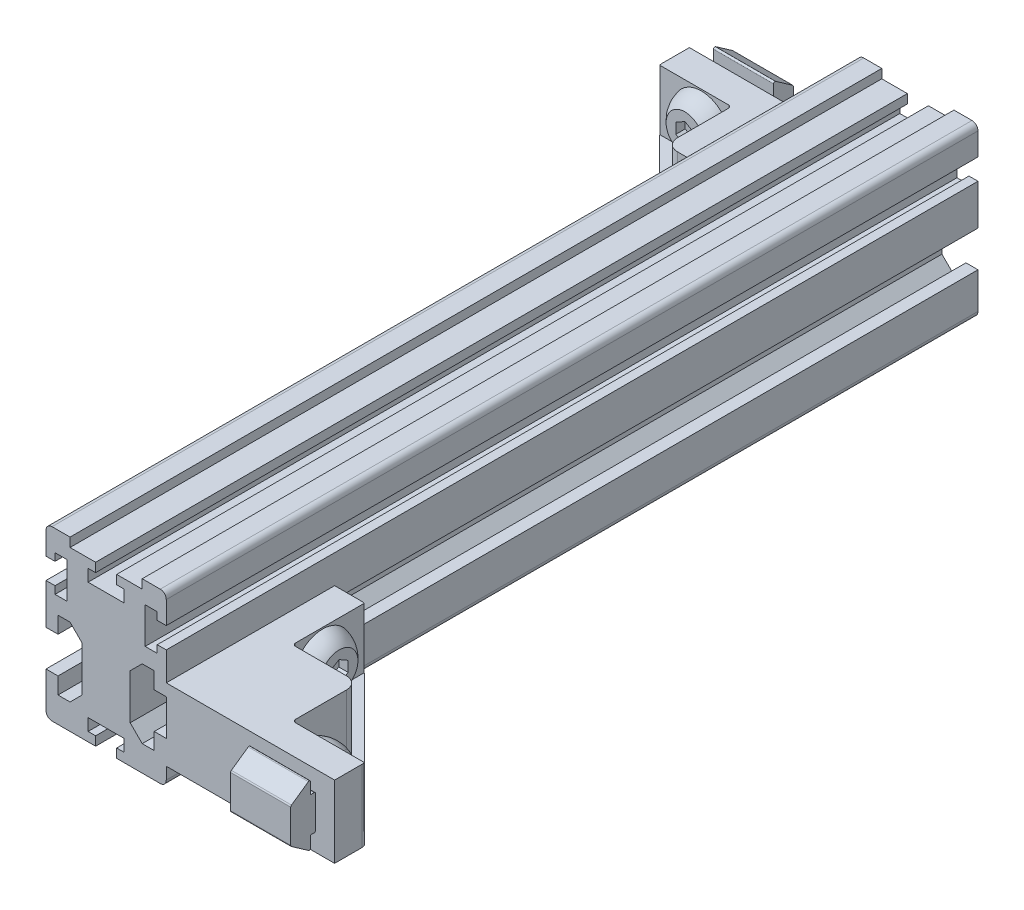
from build123d import *

# Parameters (mm, degrees)
BOSS_EXTRUDE1_DEPTH      = 135
BOSS_EXTRUDE2_START      = -7
BOSS_EXTRUDE2_DEPTH      = 12
CUT_EXTRUDE1_DEPTH       = 10
CUT_EXTRUDE2_DEPTH       = 1.56
BOSS_EXTRUDE3_DEPTH      = 5
CIRPATTERN1_COUNT        = 2
CIRPATTERN1_ANGLE        = 90
CIRPATTERN2_COUNT        = 2
CIRPATTERN2_ANGLE        = 180
CIRPATTERN2_COPY_2_DEPTH = 1.56
CIRPATTERN2_COPY_3_DEPTH = 5


with BuildPart() as part:
    # Sketch1 → Boss-Extrude1 (new body)
    with BuildSketch(Plane(origin=(24, 0, 0), x_dir=(-1, 0, 0), z_dir=(0, 0, -1))):
        with BuildLine():
            Line((14, 13), (14, 9.25))
            Line((14, 9.25), (15.5, 9.25))
            Line((15.5, 9.25), (15.5, 10.5))
            Line((15.5, 10.5), (17.5, 10.5))
            Line((17.5, 10.5), (17.5, 4.5))
            Line((17.5, 4.5), (15.5, 4.5))
            Line((15.5, 4.5), (15.5, 5.75))
            Line((15.5, 5.75), (14, 5.75))
            Line((14, 5.75), (14, -1))
            Line((14, -1), (16, -1))
            Line((16, -1), (16, 1.75))
            Line((16, 1.75), (18, 1.75))
            Line((18, 1.75), (20, -0.25))
            Line((20, -0.25), (20, -7.75))
            Line((20, -7.75), (18, -9.75))
            Line((18, -9.75), (16, -9.75))
            Line((16, -9.75), (16, -7))
            Line((16, -7), (14, -7))
            Line((14, -7), (14, -13))
            ThreePointArc((14, -13), (14.292893219, -13.707106781), (15, -14))
            Line((15, -14), (22.25, -14))
            Line((22.25, -14), (22.25, -12.5))
            Line((22.25, -12.5), (21, -12.5))
            Line((21, -12.5), (21, -10.5))
            Line((21, -10.5), (27, -10.5))
            Line((27, -10.5), (27, -12.5))
            Line((27, -12.5), (25.75, -12.5))
            Line((25.75, -12.5), (25.75, -14))
            Line((25.75, -14), (33, -14))
            ThreePointArc((33, -14), (33.707106781, -13.707106781), (34, -13))
            Line((34, -13), (34, -7))
            Line((34, -7), (32, -7))
            Line((32, -7), (32, -9.75))
            Line((32, -9.75), (30, -9.75))
            Line((30, -9.75), (28, -7.75))
            Line((28, -7.75), (28, -0.25))
            Line((28, -0.25), (30, 1.75))
            Line((30, 1.75), (32, 1.75))
            Line((32, 1.75), (32, -1))
            Line((32, -1), (34, -1))
            Line((34, -1), (34, 5.75))
            Line((34, 5.75), (32.5, 5.75))
            Line((32.5, 5.75), (32.5, 4.5))
            Line((32.5, 4.5), (30.5, 4.5))
            Line((30.5, 4.5), (30.5, 10.5))
            Line((30.5, 10.5), (32.5, 10.5))
            Line((32.5, 10.5), (32.5, 9.25))
            Line((32.5, 9.25), (34, 9.25))
            Line((34, 9.25), (34, 13))
            ThreePointArc((34, 13), (33.707106781, 13.707106781), (33, 14))
            Line((33, 14), (30, 14))
            Line((30, 14), (30, 12.5))
            Line((30, 12.5), (25.75, 12.5))
            Line((25.75, 12.5), (25.75, 11))
            Line((25.75, 11), (27, 11))
            Line((27, 11), (27, 9))
            Line((27, 9), (21, 9))
            Line((21, 9), (21, 11))
            Line((21, 11), (22.25, 11))
            Line((22.25, 11), (22.25, 12.5))
            Line((22.25, 12.5), (18, 12.5))
            Line((18, 12.5), (18, 14))
            Line((18, 14), (15, 14))
            ThreePointArc((15, 14), (14.292893219, 13.707106781), (14, 13))
        make_face()
    extrude(amount=BOSS_EXTRUDE1_DEPTH)

    # Sketch2 → Boss-Extrude2 (add)
    with BuildSketch(Plane(origin=(0, -4, 0), x_dir=(1, 0, 0), z_dir=(0, 1, 0)).offset(BOSS_EXTRUDE2_START)):
        with BuildLine():
            Line((-38, 135), (-10, 135))
            Line((-10, 135), (-10, 107))
            Line((-10, 107), (-14.585786438, 107))
            ThreePointArc((-14.585786438, 107), (-14.96846987, 107.076120467), (-15.292893219, 107.292893219))
            Line((-15.292893219, 107.292893219), (-37.707106781, 129.707106781))
            ThreePointArc((-37.707106781, 129.707106781), (-37.923879533, 130.03153013), (-38, 130.414213562))
            Line((-38, 130.414213562), (-38, 135))
        make_face()
    boss_extrude2 = extrude(amount=BOSS_EXTRUDE2_DEPTH)

    # Sketch3 → Cut-Extrude1 (cut)
    with BuildSketch(Plane(origin=(0, 1, 0), x_dir=(1, 0, 0), z_dir=(0, 1, 0))):
        with BuildLine():
            Line((-38, 130), (-26.5, 130))
            ThreePointArc((-26.5, 130), (-26.146446609, 129.853553391), (-26, 129.5))
            Line((-26, 129.5), (-26, 121))
            ThreePointArc((-26, 121), (-25.414213562, 119.585786438), (-24, 119))
            Line((-24, 119), (-15.5, 119))
            ThreePointArc((-15.5, 119), (-15.146446609, 118.853553391), (-15, 118.5))
            Line((-15, 118.5), (-15, 107))
            Line((-15, 107), (-38, 130))
        make_face()
    cut_extrude1 = extrude(amount=-CUT_EXTRUDE1_DEPTH, mode=Mode.SUBTRACT)

    # Sketch4 → Revolve1 (revolve)
    with BuildSketch(Plane(origin=(-31, 0, 0), x_dir=(0, 0, -1), z_dir=(1, 0, 0))):
        with BuildLine():
            Line((140, -4), (140, -1.5))
            Line((140, -1.5), (130, -1.5))
            Line((130, -1.5), (130, 0.75))
            ThreePointArc((130, 0.75), (128.484308853, 0.17559271), (127.25, -0.875))
            Line((127.25, -0.875), (127.25, -4))
            Line((127.25, -4), (140, -4))
        make_face()
    revolve1 = revolve(axis=Axis((-31, -4, -140), (0, 0, 1)))

    # Sketch5 → Cut-Extrude2 (cut)
    with BuildSketch(Plane.XY.offset(-127.25)):
        Polygon((-31, -2.267949192), (-32.5, -3.133974596), (-32.5, -4.866025404), (-31, -5.732050808), (-29.5, -4.866025404), (-29.5, -3.133974596), align=None)
    cut_extrude2 = extrude(amount=-CUT_EXTRUDE2_DEPTH, mode=Mode.SUBTRACT)

    # Sketch6 → Boss-Extrude3 (add, symmetric)
    with BuildSketch(Plane(origin=(-31, 0, 0), x_dir=(0, 0, -1), z_dir=(1, 0, 0))):
        with BuildLine():
            Line((136.2, -1.3), (136.2, -6.7))
            ThreePointArc((136.2, -6.7), (136.258578644, -6.841421356), (136.4, -6.9))
            Line((136.4, -6.9), (137, -6.9))
            Line((137, -6.9), (137, -8.768858987))
            ThreePointArc((137, -8.768858987), (137.123797819, -8.972871479), (137.36192258, -8.957263957))
            Line((137.36192258, -8.957263957), (140.172072931, -6.989575498))
            ThreePointArc((140.172072931, -6.989575498), (140.26610325, -6.882354469), (140.3, -6.743829885))
            Line((140.3, -6.743829885), (140.3, -1.256170115))
            ThreePointArc((140.3, -1.256170115), (140.26610325, -1.117645531), (140.172072931, -1.010424502))
            Line((140.172072931, -1.010424502), (137.36192258, 0.957263957))
            ThreePointArc((137.36192258, 0.957263957), (137.123797819, 0.972871479), (137, 0.768858987))
            Line((137, 0.768858987), (137, -1.1))
            Line((137, -1.1), (136.4, -1.1))
            ThreePointArc((136.4, -1.1), (136.258578644, -1.158578644), (136.2, -1.3))
        make_face()
    boss_extrude3 = extrude(amount=BOSS_EXTRUDE3_DEPTH, both=True)

    # CirPattern1: Revolve1, Cut-Extrude2, Boss-Extrude3 ×2 about axis
    cirpattern1_axis = Axis((-31, 15.4, -114), (0, -1, 0))
    add([revolve1.rotate(cirpattern1_axis, i * CIRPATTERN1_ANGLE / (CIRPATTERN1_COUNT - 1)) for i in range(1, CIRPATTERN1_COUNT)])
    add([cut_extrude2.rotate(cirpattern1_axis, i * CIRPATTERN1_ANGLE / (CIRPATTERN1_COUNT - 1)) for i in range(1, CIRPATTERN1_COUNT)], mode=Mode.SUBTRACT)
    add([boss_extrude3.rotate(cirpattern1_axis, i * CIRPATTERN1_ANGLE / (CIRPATTERN1_COUNT - 1)) for i in range(1, CIRPATTERN1_COUNT)])

    # CirPattern2: Boss-Extrude2, Cut-Extrude1, Revolve1, Cut-Extrude2, Boss-Extrude3 ×2 about axis
    cirpattern2_axis = Axis((0, 15.4, -67.5), (0, -1, 0))
    add([boss_extrude2.rotate(cirpattern2_axis, i * CIRPATTERN2_ANGLE / (CIRPATTERN2_COUNT - 1)) for i in range(1, CIRPATTERN2_COUNT)])
    add([cut_extrude1.rotate(cirpattern2_axis, i * CIRPATTERN2_ANGLE / (CIRPATTERN2_COUNT - 1)) for i in range(1, CIRPATTERN2_COUNT)], mode=Mode.SUBTRACT)
    add([revolve1.rotate(cirpattern2_axis, i * CIRPATTERN2_ANGLE / (CIRPATTERN2_COUNT - 1)) for i in range(1, CIRPATTERN2_COUNT)])
    add([cut_extrude2.rotate(cirpattern2_axis, i * CIRPATTERN2_ANGLE / (CIRPATTERN2_COUNT - 1)) for i in range(1, CIRPATTERN2_COUNT)], mode=Mode.SUBTRACT)
    add([boss_extrude3.rotate(cirpattern2_axis, i * CIRPATTERN2_ANGLE / (CIRPATTERN2_COUNT - 1)) for i in range(1, CIRPATTERN2_COUNT)])

    # CirPattern2 copy 1 sketch → CirPattern2 copy 1 (revolve)
    with BuildSketch(Plane(origin=(145, 0, -21), x_dir=(-1, 0, 0), z_dir=(0, 0, -1))):
        with BuildLine():
            Line((140, -4), (140, -1.5))
            Line((140, -1.5), (130, -1.5))
            Line((130, -1.5), (130, 0.75))
            ThreePointArc((130, 0.75), (128.484308853, 0.17559271), (127.25, -0.875))
            Line((127.25, -0.875), (127.25, -4))
            Line((127.25, -4), (140, -4))
        make_face()
    revolve(axis=Axis((5, -4, -21), (1, 0, 0)))

    # CirPattern2 copy 2 sketch → CirPattern2 copy 2 (cut)
    with BuildSketch(Plane(origin=(17.75, 0, -52), x_dir=(0, 0, -1), z_dir=(1, 0, 0))):
        Polygon((-31, -2.267949192), (-32.5, -3.133974596), (-32.5, -4.866025404), (-31, -5.732050808), (-29.5, -4.866025404), (-29.5, -3.133974596), align=None)
    extrude(amount=-CIRPATTERN2_COPY_2_DEPTH, mode=Mode.SUBTRACT)

    # CirPattern2 copy 3 sketch → CirPattern2 copy 3 (add, symmetric)
    with BuildSketch(Plane(origin=(145, 0, -21), x_dir=(-1, 0, 0), z_dir=(0, 0, -1))):
        with BuildLine():
            Line((136.2, -1.3), (136.2, -6.7))
            ThreePointArc((136.2, -6.7), (136.258578644, -6.841421356), (136.4, -6.9))
            Line((136.4, -6.9), (137, -6.9))
            Line((137, -6.9), (137, -8.768858987))
            ThreePointArc((137, -8.768858987), (137.123797819, -8.972871479), (137.36192258, -8.957263957))
            Line((137.36192258, -8.957263957), (140.172072931, -6.989575498))
            ThreePointArc((140.172072931, -6.989575498), (140.26610325, -6.882354469), (140.3, -6.743829885))
            Line((140.3, -6.743829885), (140.3, -1.256170115))
            ThreePointArc((140.3, -1.256170115), (140.26610325, -1.117645531), (140.172072931, -1.010424502))
            Line((140.172072931, -1.010424502), (137.36192258, 0.957263957))
            ThreePointArc((137.36192258, 0.957263957), (137.123797819, 0.972871479), (137, 0.768858987))
            Line((137, 0.768858987), (137, -1.1))
            Line((137, -1.1), (136.4, -1.1))
            ThreePointArc((136.4, -1.1), (136.258578644, -1.158578644), (136.2, -1.3))
        make_face()
    extrude(amount=CIRPATTERN2_COPY_3_DEPTH, both=True)


solid = part.part
